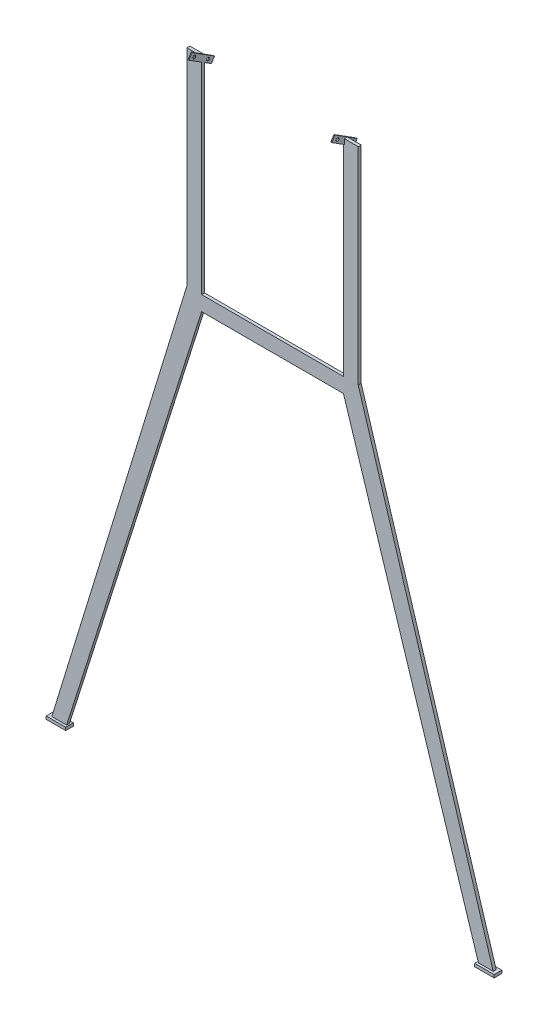
from build123d import *

# Parameters (mm, degrees)
SKETCH2_W           = 1500
SKETCH2_H           = 2198.57
BOSS_EXTRUDE1_DEPTH = 10
SKETCH3_W           = 480
SKETCH3_H           = 698.5704
SKETCH3_W_2         = 460
CUT_EXTRUDE1_DEPTH  = 1746.724604551
CUT_EXTRUDE3_DEPTH  = 10
CUT_EXTRUDE4_DEPTH  = 1746.724604551
BOSS_EXTRUDE2_DEPTH = 3
BOSS_EXTRUDE3_DEPTH = 3
SKETCH13_R          = 5
CUT_EXTRUDE5_DEPTH  = 1829.189928544
SKETCH14_R          = 5
CUT_EXTRUDE6_DEPTH  = 1829.189928544
SKETCH15_W          = 66
SKETCH15_H          = 26
BOSS_EXTRUDE5_DEPTH = 10
SKETCH16_W          = 66
SKETCH16_H          = 26
BOSS_EXTRUDE9_DEPTH = 10


with BuildPart() as part:
    # Sketch2 → Boss-Extrude1 (new body)
    with BuildSketch(Plane.XY):
        with Locations((79.505300353, -436.740830389)):
            Rectangle(SKETCH2_W, SKETCH2_H)
    extrude(amount=BOSS_EXTRUDE1_DEPTH)

    # Sketch3 → Cut-Extrude1 (cut, through all)
    with BuildSketch(Plane.XY.offset(10)):
        with Locations((79.505300353, 313.258969611)):
            Rectangle(SKETCH3_W, SKETCH3_H)
        with Locations((-440.494699647, 313.258969611)):
            Rectangle(SKETCH3_W_2, SKETCH3_H)
        with Locations((599.505300353, 313.258969611)):
            Rectangle(SKETCH3_W_2, SKETCH3_H)
    extrude(amount=-CUT_EXTRUDE1_DEPTH, mode=Mode.SUBTRACT)

    # Sketch9 → Cut-Extrude3 (cut)
    with BuildSketch(Plane(origin=(0, 0, 0), x_dir=(-1, 0, 0), z_dir=(0, 0, -1))):
        Polygon((-369.505300353, -36.026230389), (-829.505300353, -36.026230389), (-829.505300353, -1536.025830389), align=None)
        Polygon((210.494699647, -36.026230389), (670.494699647, -1536.025830389), (670.494699647, -36.026230389), align=None)
    extrude(amount=-CUT_EXTRUDE3_DEPTH, mode=Mode.SUBTRACT)

    # Sketch10 → Cut-Extrude4 (cut, through all)
    with BuildSketch(Plane(origin=(0, 0, 0), x_dir=(-1, 0, 0), z_dir=(0, 0, -1))):
        Polygon((-319.505300353, -86.026230389), (-779.505300353, -1536.025830389), (620.494699647, -1536.025830389), (160.494699647, -86.026230389), align=None)
    extrude(amount=-CUT_EXTRUDE4_DEPTH, mode=Mode.SUBTRACT)

    # Sketch11 → Boss-Extrude2 (add)
    with BuildSketch(Plane.ZY.offset(-319.505300353)):
        Polygon((0, 662.544169611), (42.246296146, 689.288336489), (52.943962897, 672.389818031), (-23.099370165, 624.250317651), (-33.797036917, 641.148836109), align=None)
    extrude(amount=-BOSS_EXTRUDE2_DEPTH)

    # Sketch12 → Boss-Extrude3 (add)
    with BuildSketch(Plane(origin=(-160.494699647, 0, 0), x_dir=(0, 0, -1), z_dir=(1, 0, 0))):
        Polygon((0, 662.544169611), (33.797036917, 641.148836109), (23.099370165, 624.250317651), (-52.943962897, 672.389818031), (-42.246296146, 689.288336489), align=None)
    extrude(amount=-BOSS_EXTRUDE3_DEPTH)

    # Sketch13 → Cut-Extrude5 (cut, through all)
    with BuildSketch(Plane(origin=(-160.494699647, 0, 0), x_dir=(0, 0, -1), z_dir=(1, 0, 0))):
        with Locations(Location((-34.683917705, 672.665589051, 0), (0, 0, 90))):
            Circle(SKETCH13_R)
        with Locations(Location((12.037265881, 643.088578886, 0), (0, 0, 90))):
            Circle(SKETCH13_R)
    extrude(amount=-CUT_EXTRUDE5_DEPTH, mode=Mode.SUBTRACT)

    # Sketch14 → Cut-Extrude6 (cut, through all)
    with BuildSketch(Plane.ZY.offset(-319.505300353)):
        with Locations(Location((32.895909771, 671.533684318, 0), (0, 0, 270))):
            Circle(SKETCH14_R)
        with Locations(Location((-16.256513993, 640.412580131, 0), (0, 0, 270))):
            Circle(SKETCH14_R)
    extrude(amount=-CUT_EXTRUDE6_DEPTH, mode=Mode.SUBTRACT)

    # Sketch15 → Boss-Extrude5 (add)
    with BuildSketch(Plane.XZ.offset(1536.025830389)):
        with Locations((804.505300353, 5)):
            Rectangle(SKETCH15_W, SKETCH15_H)
    extrude(amount=-BOSS_EXTRUDE5_DEPTH)

    # Sketch16 → Boss-Extrude9 (add)
    with BuildSketch(Plane.XZ.offset(1536.025830389)):
        with Locations((-645.494699647, 5)):
            Rectangle(SKETCH16_W, SKETCH16_H)
    extrude(amount=-BOSS_EXTRUDE9_DEPTH)


solid = part.part
